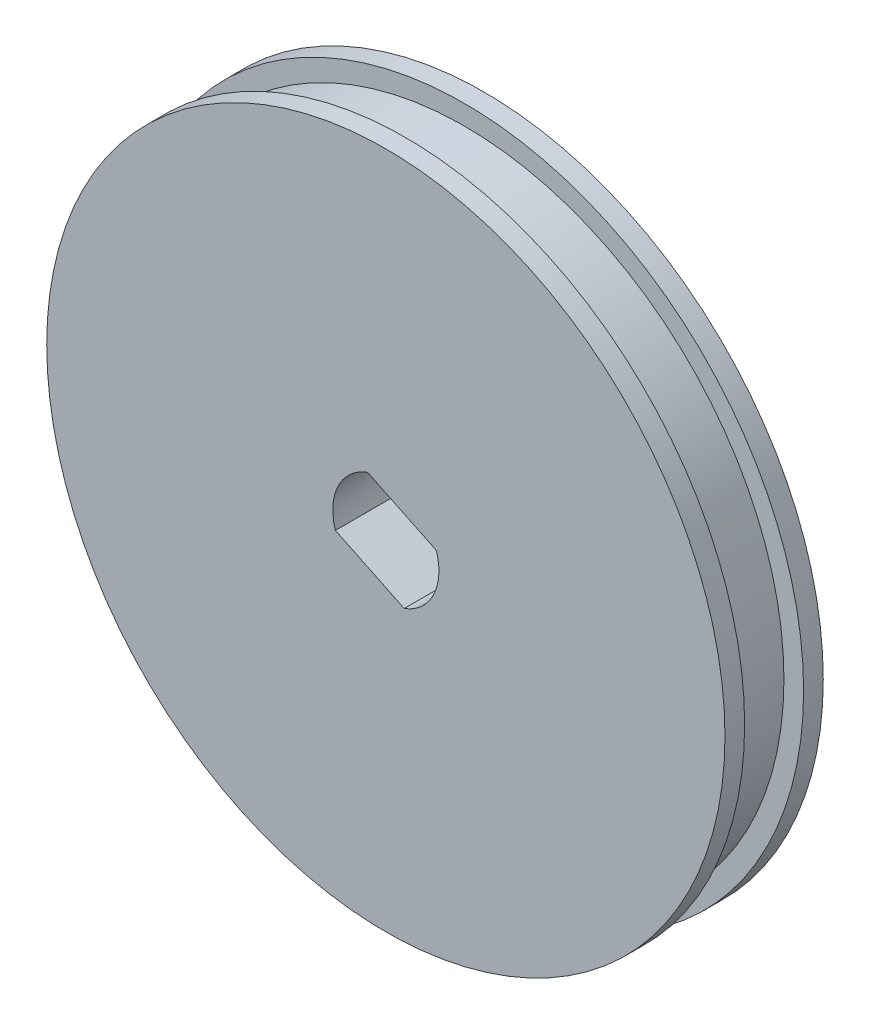
from build123d import *

# Parameters (mm, degrees)
SKETCH_1_R          = 16.25
EXTRUDE_1_DEPTH     = 1.5
SKETCH_2_R          = 17.25
EXTRUDE_2_DEPTH     = 1
CUT_EXTRUDE_1_DEPTH = 51.564922409


with BuildPart() as part:
    # 草图1 → 凸台-拉伸1 (new, symmetric)
    with BuildSketch(Plane.XY):
        with Locations((22.416532439, -13.707674049)):
            Circle(SKETCH_1_R)
    extrude(amount=EXTRUDE_1_DEPTH, both=True)

    # 草图2 → 凸台-拉伸2 (add)
    with BuildSketch(Plane.XY.offset(1.5)):
        with Locations((22.416532439, -13.707674049)):
            Circle(SKETCH_2_R)
    extrude_2 = extrude(amount=EXTRUDE_2_DEPTH)

    # 镜向1: 凸台-拉伸2 across plane
    add(extrude_2.mirror(Plane.XY))

    # 草图3 → 切除-拉伸1 (cut, through all)
    with BuildSketch(Plane.XY.offset(2.5)):
        with BuildLine():
            Line((24.98184237, -12.86554285), (21.483879203, -11.17387099))
            ThreePointArc((21.483879203, -11.17387099), (19.985859773, -12.532161228), (19.851222508, -14.549805248))
            Line((19.851222508, -14.549805248), (23.349185675, -16.241477108))
            ThreePointArc((23.349185675, -16.241477108), (24.847205105, -14.88318687), (24.98184237, -12.86554285))
        make_face()
    extrude(amount=-CUT_EXTRUDE_1_DEPTH, mode=Mode.SUBTRACT)


solid = part.part
